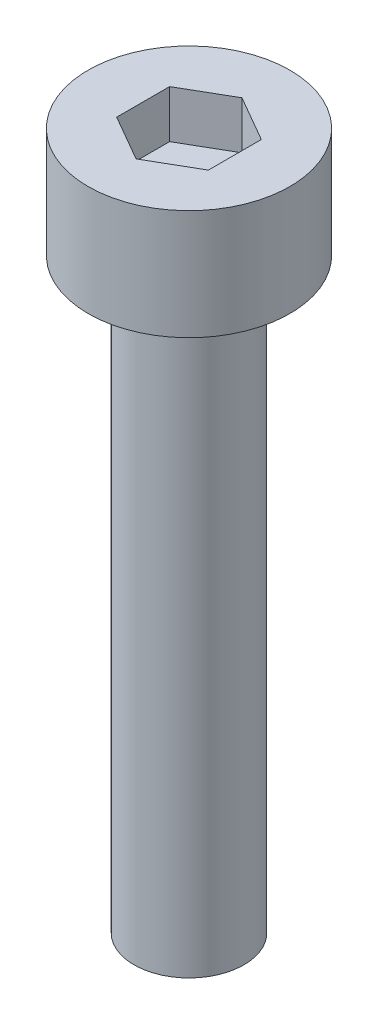
from build123d import *

# Parameters (mm, degrees)
SKETCH1_R           = 2.75
BOSS_EXTRUDE1_DEPTH = 3
CUT_EXTRUDE1_DEPTH  = 1.3
SKETCH3_R           = 1.5
BOSS_EXTRUDE2_DEPTH = 16


with BuildPart() as part:
    # Sketch1 → Boss-Extrude1 (new body)
    with BuildSketch(Plane(origin=(0, 0, 0), x_dir=(1, 0, 0), z_dir=(0, 1, 0))):
        with Locations(Location((0, 0, 0), (0, 0, 270))):
            Circle(SKETCH1_R)
    extrude(amount=BOSS_EXTRUDE1_DEPTH)

    # Sketch2 → Cut-Extrude1 (cut)
    with BuildSketch(Plane(origin=(0, 3, 0), x_dir=(1, 0, 0), z_dir=(0, 1, 0))):
        Polygon((0, 1.443375673), (-1.25, 0.721687836), (-1.25, -0.721687836), (0, -1.443375673), (1.25, -0.721687836), (1.25, 0.721687836), align=None)
    extrude(amount=-CUT_EXTRUDE1_DEPTH, mode=Mode.SUBTRACT)

    # Sketch3 → Boss-Extrude2 (add)
    with BuildSketch(Plane.XZ):
        with Locations(Location((0, 0, 0), (0, 0, 270))):
            Circle(SKETCH3_R)
    extrude(amount=BOSS_EXTRUDE2_DEPTH)


solid = part.part
